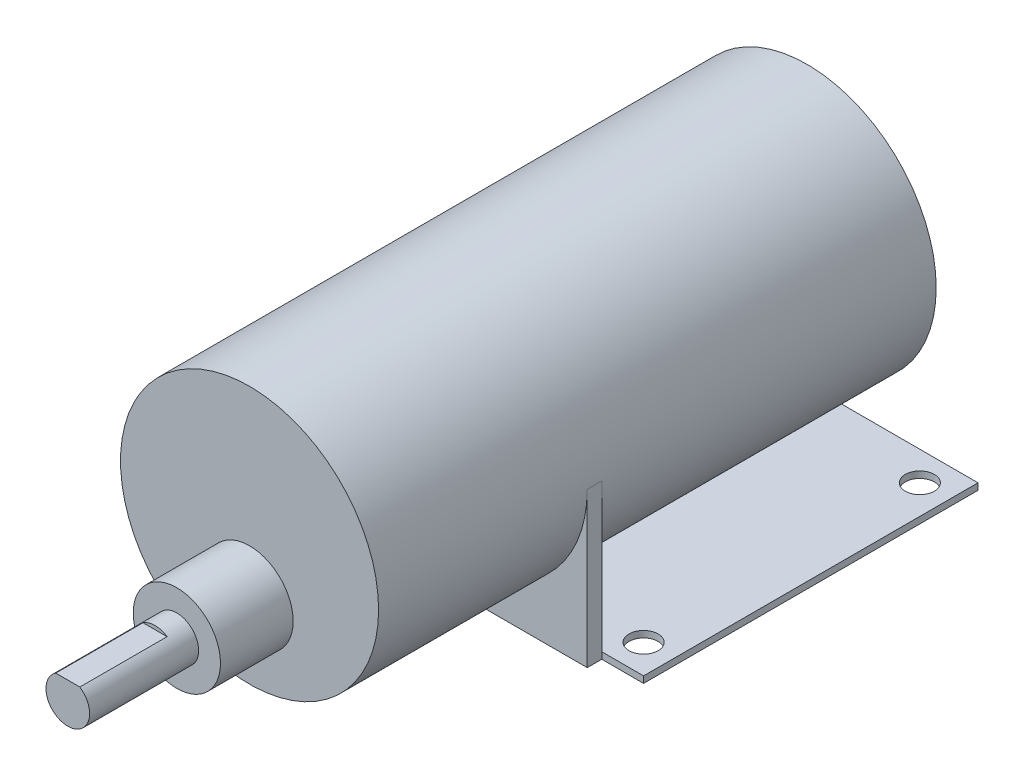
from build123d import *

# Parameters (mm, degrees)
SKETCH1_R           = 17.75
BOSS_EXTRUDE1_DEPTH = 46
BOSS_EXTRUDE2_DEPTH = 2
BOSS_EXTRUDE3_DEPTH = 46
SKETCH4_R           = 17.75
BOSS_EXTRUDE4_DEPTH = 28.7
SKETCH5_R           = 6
BOSS_EXTRUDE5_DEPTH = 10
SKETCH6_R           = 3
BOSS_EXTRUDE6_DEPTH = 15
CUT_EXTRUDE1_START  = -12
CUT_EXTRUDE1_DEPTH  = 12
SKETCH8_R           = 2
CUT_EXTRUDE7_DEPTH  = 12


with BuildPart() as part:
    # Sketch1 → Boss-Extrude1 (new body)
    with BuildSketch(Plane.XY):
        Circle(SKETCH1_R)
    extrude(amount=BOSS_EXTRUDE1_DEPTH)

    # Sketch2 → Boss-Extrude2 (add)
    with BuildSketch(Plane.XY.offset(46)):
        with BuildLine():
            Line((-17.75, -21.25), (17.75, -21.25))
            Line((17.75, -21.25), (17.75, 0))
            ThreePointArc((17.75, 0), (0, 17.75), (-17.75, 0))
            Line((-17.75, 0), (-17.75, -21.25))
        make_face()
    extrude(amount=BOSS_EXTRUDE2_DEPTH)

    # Sketch3 → Boss-Extrude3 (add)
    with BuildSketch(Plane(origin=(0, 0, 46), x_dir=(-1, 0, 0), z_dir=(0, 0, -1))):
        Polygon((0, -21.25), (23.5, -21.25), (23.5, -20.35), (-23.5, -20.35), (-23.5, -21.25), align=None)
    extrude(amount=BOSS_EXTRUDE3_DEPTH)

    # Sketch4 → Boss-Extrude4 (add)
    with BuildSketch(Plane.XY.offset(48)):
        Circle(SKETCH4_R)
    extrude(amount=BOSS_EXTRUDE4_DEPTH)

    # Sketch5 → Boss-Extrude5 (add)
    with BuildSketch(Plane.XY.offset(76.7)):
        with Locations((0, -7.25)):
            Circle(SKETCH5_R)
    extrude(amount=BOSS_EXTRUDE5_DEPTH)

    # Sketch6 → Boss-Extrude6 (add)
    with BuildSketch(Plane.XY.offset(86.7)):
        with Locations((0, -7.25)):
            Circle(SKETCH6_R)
    extrude(amount=BOSS_EXTRUDE6_DEPTH)

    # Sketch7 → Cut-Extrude1 (cut)
    with BuildSketch(Plane.XY.offset(101.7).offset(CUT_EXTRUDE1_START)):
        with BuildLine():
            Line((-1.658312395, -4.75), (1.658312395, -4.75))
            ThreePointArc((1.658312395, -4.75), (0, -4.25), (-1.658312395, -4.75))
        make_face()
    extrude(amount=CUT_EXTRUDE1_DEPTH, mode=Mode.SUBTRACT)

    # Sketch8 → Cut-Extrude7 (cut)
    with BuildSketch(Plane(origin=(0, -21.25, 0), x_dir=(-1, 0, 0), z_dir=(0, -1, 0))):
        with Locations(Location((19.5, -42, 0), (0, 0, 90))):
            Circle(SKETCH8_R)
        with Locations(Location((-19.5, -42, 0), (0, 0, 90))):
            Circle(SKETCH8_R)
        with Locations(Location((19.5, -4, 0), (0, 0, 90))):
            Circle(SKETCH8_R)
        with Locations(Location((-19.5, -4, 0), (0, 0, 90))):
            Circle(SKETCH8_R)
    extrude(amount=-CUT_EXTRUDE7_DEPTH, mode=Mode.SUBTRACT)


solid = part.part
